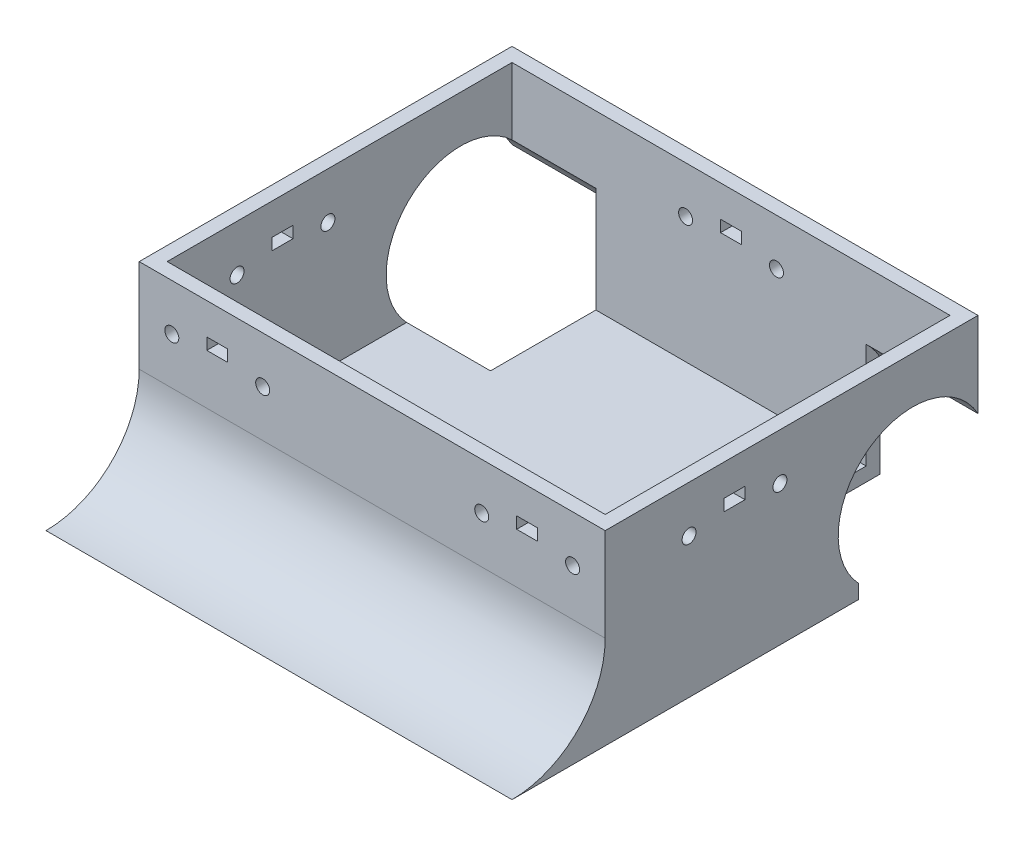
from build123d import *

# Parameters (mm, degrees)
ESBO_O1_W                   = 100
ESBO_O1_H                   = 100
RESSALTO_EXTRUS_O1_DEPTH    = 20
CORTE_EXTRUS_O1_DEPTH       = 74.484692283
CORTE_EXTRUS_O1_DEPTH_BACK  = 74.484692283
ESBO_O2_R                   = 20
ESBO_O3_W                   = 94
ESBO_O3_H                   = 74
CORTE_EXTRUS_O2_DEPTH       = 74.484692283
ESBO_O5_W                   = 94
ESBO_O5_H                   = 74
CORTE_EXTRUS_O3_DEPTH       = 17
CORTE_EXTRUS_O4_START       = 50
ESBO_O6_R                   = 16
CORTE_EXTRUS_O4_DEPTH       = 21
CORTE_EXTRUS_O5_START       = -29
ESBO_O6_4_R                 = 16
CORTE_EXTRUS_O5_DEPTH       = 21
ESBO_O7_W                   = 21
ESBO_O7_H                   = 3.872983347
CORTE_EXTRUS_O6_DEPTH       = 21
ESBO_O8_R                   = 1.5
ESBO_O8_W                   = 4.5
ESBO_O8_H                   = 2.5
CORTE_EXTRUS_O8_DEPTH       = 74.484692283
ESBO_O9_R                   = 1.5
ESBO_O9_W                   = 4.5
ESBO_O9_H                   = 2.5
CORTE_EXTRUS_O9_DEPTH       = 74.484692283
CORTE_EXTRUS_O10_DEPTH      = 74.484692283
CORTE_EXTRUS_O10_DEPTH_BACK = 74.484692283
ESBO_O10_R                  = 1.5
ESBO_O10_W                  = 4.5
ESBO_O10_H                  = 2.5


with BuildPart() as part:
    # Esboço1 → Ressalto-extrusão1 (new, symmetric)
    with BuildSketch(Plane(origin=(0, 0, 0), x_dir=(1, 0, 0), z_dir=(0, 1, 0))):
        Rectangle(ESBO_O1_W, ESBO_O1_H)
    extrude(amount=RESSALTO_EXTRUS_O1_DEPTH, both=True)

    # Esboço2 → Corte-extrusão1 (cut, two sides: drawn at the far end of the back side and taken through both)
    with BuildSketch(Plane(origin=(0, 0, 0), x_dir=(0, 0, -1), z_dir=(1, 0, 0)).offset(-CORTE_EXTRUS_O1_DEPTH_BACK)):
        with BuildLine():
            Line((-30, 20), (-50, 20))
            ThreePointArc((-50, 20), (-35.857864376, 14.142135624), (-30, 0))
            Line((-30, 0), (-30, 20))
        make_face()
        with Locations((-50, 0)):
            Circle(ESBO_O2_R)
    extrude(amount=CORTE_EXTRUS_O1_DEPTH + CORTE_EXTRUS_O1_DEPTH_BACK, mode=Mode.SUBTRACT)

    # Esboço3 → Corte-extrusão2 (cut, through all)
    with BuildSketch(Plane(origin=(0, 0, 0), x_dir=(1, 0, 0), z_dir=(0, 1, 0))):
        with Locations((0, 10)):
            Rectangle(ESBO_O3_W, ESBO_O3_H)
    extrude(amount=CORTE_EXTRUS_O2_DEPTH, mode=Mode.SUBTRACT)

    # Esboço5 → Corte-extrusão3 (cut)
    with BuildSketch(Plane(origin=(0, 0, 0), x_dir=(1, 0, 0), z_dir=(0, 1, 0))):
        with Locations((0, 10)):
            Rectangle(ESBO_O5_W, ESBO_O5_H)
    extrude(amount=-CORTE_EXTRUS_O3_DEPTH, mode=Mode.SUBTRACT)

    # Esboço6 → Corte-extrusão4 (cut)
    with BuildSketch(Plane(origin=(0, 0, 0), x_dir=(0, 0, -1), z_dir=(1, 0, 0)).offset(CORTE_EXTRUS_O4_START)):
        with Locations((36, -6)):
            Circle(ESBO_O6_R)
        with BuildLine():
            ThreePointArc((52, -6), (47.313708499, -17.313708499), (36, -22))
            Line((36, -22), (52, -22))
            Line((52, -22), (52, -6))
        make_face()
    extrude(amount=-CORTE_EXTRUS_O4_DEPTH, mode=Mode.SUBTRACT)

    # Esboço6<4> → Corte-extrusão5 (cut)
    with BuildSketch(Plane(origin=(0, 0, 0), x_dir=(0, 0, -1), z_dir=(1, 0, 0)).offset(CORTE_EXTRUS_O5_START)):
        with BuildLine():
            ThreePointArc((52, -6), (47.313708499, -17.313708499), (36, -22))
            Line((36, -22), (52, -22))
            Line((52, -22), (52, -6))
        make_face()
        with Locations((36, -6)):
            Circle(ESBO_O6_4_R)
    extrude(amount=-CORTE_EXTRUS_O5_DEPTH, mode=Mode.SUBTRACT)

    # Esboço7 → Corte-extrusão6 (cut)
    with BuildSketch(Plane(origin=(0, 0, 0), x_dir=(1, 0, 0), z_dir=(0, 1, 0))):
        with Locations((-39.5, 26.317541635)):
            Rectangle(ESBO_O7_W, ESBO_O7_H)
        with Locations((39.5, 26.317541635)):
            Rectangle(ESBO_O7_W, ESBO_O7_H)
    extrude(amount=-CORTE_EXTRUS_O6_DEPTH, mode=Mode.SUBTRACT)

    # Esboço8 → Corte-extrusão8 (cut, through all)
    with BuildSketch(Plane.XY):
        with Locations(Location((-43, 10, 0), (0, 0, 180))):
            Circle(ESBO_O8_R)
        with Locations(Location((-23.5, 10, 0), (0, 0, 180))):
            Circle(ESBO_O8_R)
        with Locations(Location((23.5, 10, 0), (0, 0, 180))):
            Circle(ESBO_O8_R)
        with Locations(Location((43, 10, 0), (0, 0, 180))):
            Circle(ESBO_O8_R)
        with Locations((33.25, 12)):
            Rectangle(ESBO_O8_W, ESBO_O8_H)
        with Locations((-33.25, 12)):
            Rectangle(ESBO_O8_W, ESBO_O8_H)
    extrude(amount=CORTE_EXTRUS_O8_DEPTH, mode=Mode.SUBTRACT)

    # Esboço9 → Corte-extrusão9 (cut, through all)
    with BuildSketch(Plane.XY):
        with Locations((-9.75, 10)):
            Circle(ESBO_O9_R)
        with Locations((9.75, 10)):
            Circle(ESBO_O9_R)
        with Locations((0, 12)):
            Rectangle(ESBO_O9_W, ESBO_O9_H)
    extrude(amount=-CORTE_EXTRUS_O9_DEPTH, mode=Mode.SUBTRACT)

    # Esboço10 → Corte-extrusão10 (cut, two sides: drawn at the far end of the back side and taken through both)
    with BuildSketch(Plane(origin=(0, 0, 0), x_dir=(0, 0, -1), z_dir=(1, 0, 0)).offset(-CORTE_EXTRUS_O10_DEPTH_BACK)):
        with Locations((-12, 10)):
            Circle(ESBO_O10_R)
        with Locations((7.5, 10)):
            Circle(ESBO_O10_R)
        with Locations((-2.25, 12)):
            Rectangle(ESBO_O10_W, ESBO_O10_H)
    extrude(amount=CORTE_EXTRUS_O10_DEPTH + CORTE_EXTRUS_O10_DEPTH_BACK, mode=Mode.SUBTRACT)


solid = part.part
